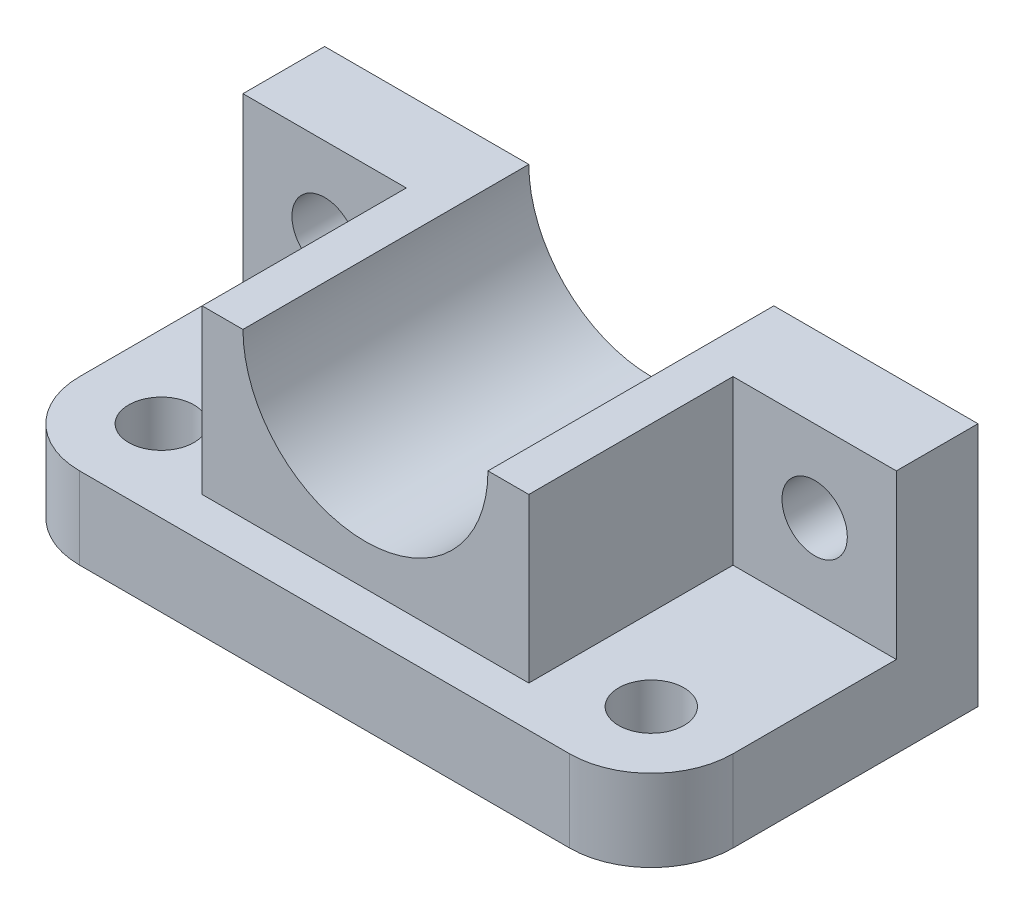
from build123d import *

# Parameters (mm, degrees)
SKETCH1_R           = 4
BOSS_EXTRUDE1_DEPTH = 10
BOSS_EXTRUDE2_DEPTH = 10
BOSS_EXTRUDE3_DEPTH = 35
SKETCH3_R           = 4
CUT_EXTRUDE1_DEPTH  = 59.309518948


with BuildPart() as part:
    # Sketch1 → Boss-Extrude1 (new body)
    with BuildSketch(Plane(origin=(0, 0, 0), x_dir=(1, 0, 0), z_dir=(0, 1, 0))):
        with BuildLine():
            Line((-30, -20), (30, -20))
            ThreePointArc((30, -20), (37.071067812, -17.071067812), (40, -10))
            Line((40, -10), (40, 20))
            Line((40, 20), (-40, 20))
            Line((-40, 20), (-40, -10))
            ThreePointArc((-40, -10), (-37.071067812, -17.071067812), (-30, -20))
        make_face()
        with Locations((-30, -10)):
            Circle(SKETCH1_R, mode=Mode.SUBTRACT)
        with Locations((30, -10)):
            Circle(SKETCH1_R, mode=Mode.SUBTRACT)
    extrude(amount=BOSS_EXTRUDE1_DEPTH)

    # Sketch2 → Boss-Extrude2 (add)
    with BuildSketch(Plane(origin=(0, 0, -20), x_dir=(-1, 0, 0), z_dir=(0, 0, -1))):
        Polygon((40, 0), (40, 30), (20, 30), (20, 10), (-20, 10), (-20, 30), (-40, 30), (-40, 0), align=None)
    extrude(amount=-BOSS_EXTRUDE2_DEPTH)

    # Sketch2<3> → Boss-Extrude3 (add)
    with BuildSketch(Plane(origin=(0, 0, -20), x_dir=(-1, 0, 0), z_dir=(0, 0, -1))):
        with BuildLine():
            Line((-20, 10), (20, 10))
            Line((20, 10), (20, 30))
            Line((20, 30), (15, 30))
            ThreePointArc((15, 30), (0, 15), (-15, 30))
            Line((-15, 30), (-20, 30))
            Line((-20, 30), (-20, 10))
        make_face()
    extrude(amount=-BOSS_EXTRUDE3_DEPTH)

    # Sketch3 → Cut-Extrude1 (cut, through all)
    with BuildSketch(Plane.XY.offset(-10)):
        with Locations((30, 20)):
            Circle(SKETCH3_R)
        with Locations((-30, 20)):
            Circle(SKETCH3_R)
    extrude(amount=-CUT_EXTRUDE1_DEPTH, mode=Mode.SUBTRACT)


solid = part.part
